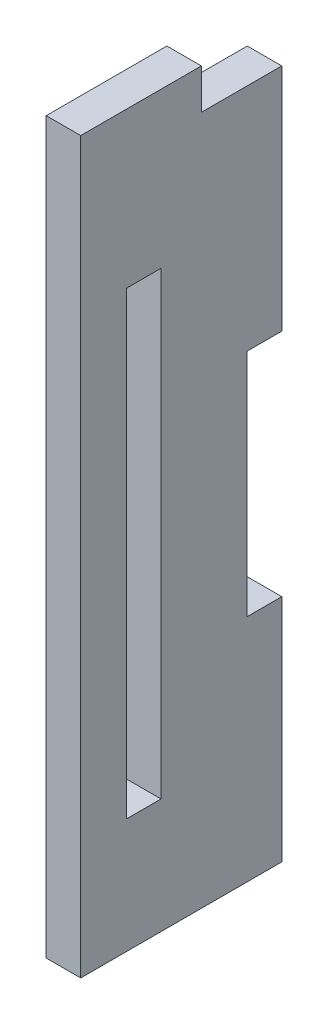
from build123d import *

# Parameters (mm, degrees)
CROQUIS1_W              = 35
CROQUIS1_H              = 120
SALIENTE_EXTRUIR1_DEPTH = 6
CROQUIS3_W              = 6.02
CROQUIS3_H              = 40.02
CORTAR_EXTRUIR1_DEPTH   = 126.143917151
CROQUIS4_W              = 6.05
CROQUIS4_H              = 80
CORTAR_EXTRUIR2_DEPTH   = 10
CROQUIS5_W              = 21
CROQUIS5_H              = 7
SALIENTE_EXTRUIR2_DEPTH = 6


with BuildPart() as part:
    # Croquis1 → Saliente-Extruir1 (new body)
    with BuildSketch(Plane(origin=(0, 0, 0), x_dir=(0, 0, -1), z_dir=(1, 0, 0))):
        with Locations((17.5, 60)):
            Rectangle(CROQUIS1_W, CROQUIS1_H)
    extrude(amount=SALIENTE_EXTRUIR1_DEPTH)

    # Croquis3 → Cortar-Extruir1 (cut, through all)
    with BuildSketch(Plane(origin=(0, 0, 0), x_dir=(0, 0, -1), z_dir=(1, 0, 0))):
        with Locations((31.99, 60)):
            Rectangle(CROQUIS3_W, CROQUIS3_H)
    extrude(amount=CORTAR_EXTRUIR1_DEPTH, mode=Mode.SUBTRACT)

    # Croquis4 → Cortar-Extruir2 (cut)
    with BuildSketch(Plane(origin=(0, 0, 0), x_dir=(0, 0, -1), z_dir=(1, 0, 0))):
        with Locations((10.955, 60)):
            Rectangle(CROQUIS4_W, CROQUIS4_H)
    extrude(amount=CORTAR_EXTRUIR2_DEPTH, mode=Mode.SUBTRACT)

    # Croquis5 → Saliente-Extruir2 (add)
    with BuildSketch(Plane(origin=(0, 0, 0), x_dir=(0, 0, -1), z_dir=(1, 0, 0))):
        with Locations((10.5, 123.5)):
            Rectangle(CROQUIS5_W, CROQUIS5_H)
    extrude(amount=SALIENTE_EXTRUIR2_DEPTH)


solid = part.part
